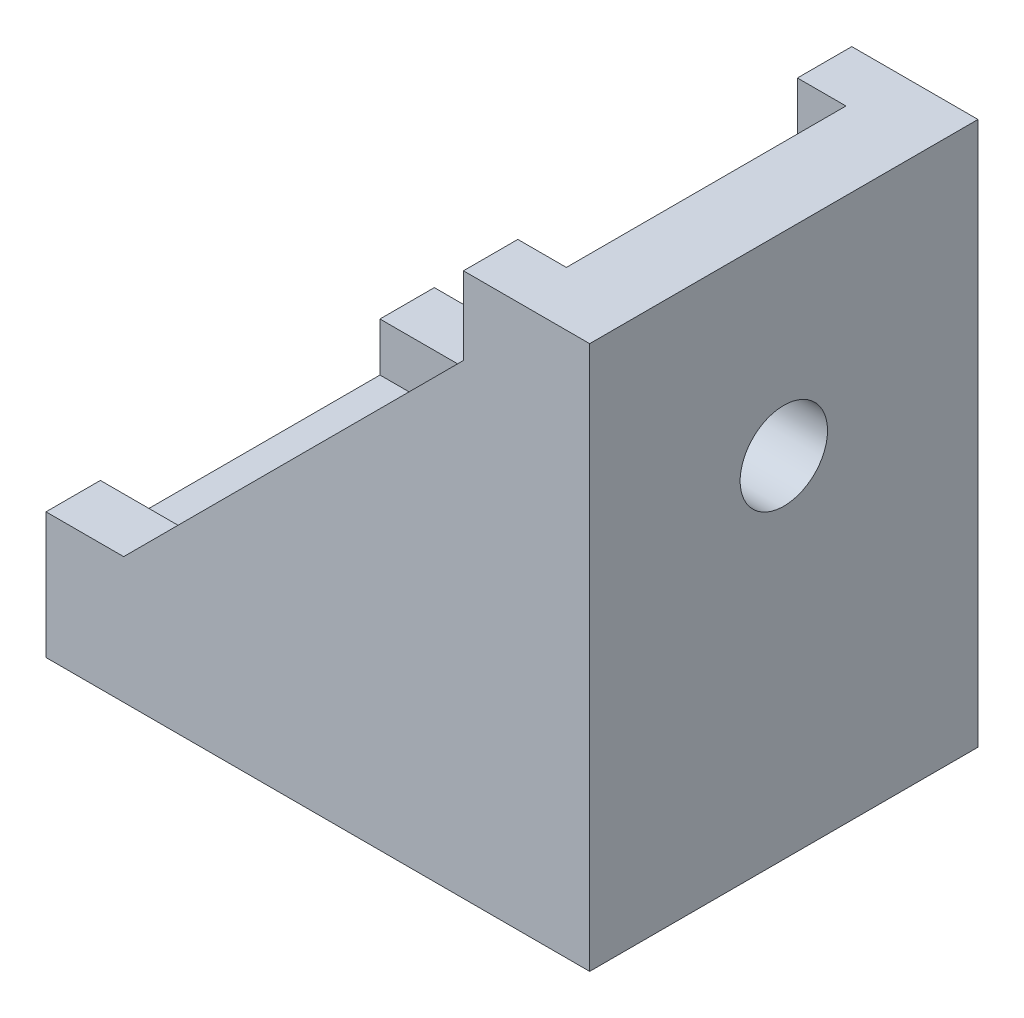
from build123d import *

# Parameters (mm, degrees)
SKETCH_1_W          = 28
SKETCH_1_H          = 28
EXTRUDE_1_DEPTH     = 20
CUT_EXTRUDE_1_DEPTH = 20
SKETCH_3_W          = 24
SKETCH_3_H          = 14.4
CUT_EXTRUDE_2_DEPTH = 24
SKETCH_4_R          = 2.25
CUT_EXTRUDE_3_DEPTH = 10
SKETCH_5_R          = 2.25
CUT_EXTRUDE_4_DEPTH = 10


with BuildPart() as part:
    # 草图1 → 凸台-拉伸1 (new body)
    with BuildSketch(Plane.XY):
        with Locations((14, 14)):
            Rectangle(SKETCH_1_W, SKETCH_1_H)
    extrude(amount=EXTRUDE_1_DEPTH)

    # 草图2 → 切除-拉伸1 (cut)
    with BuildSketch(Plane.XY.offset(20)):
        Polygon((21.5, 28), (21.5, 24), (4, 6.5), (0, 6.5), (0, 28), align=None)
    extrude(amount=-CUT_EXTRUDE_1_DEPTH, mode=Mode.SUBTRACT)

    # 草图3 → 切除-拉伸2 (cut)
    with BuildSketch(Plane(origin=(0, 28, 0), x_dir=(1, 0, 0), z_dir=(0, 1, 0))):
        with Locations((12, -10)):
            Rectangle(SKETCH_3_W, SKETCH_3_H)
    extrude(amount=-CUT_EXTRUDE_2_DEPTH, mode=Mode.SUBTRACT)

    # 草图4 → 切除-拉伸3 (cut)
    with BuildSketch(Plane.XZ):
        with Locations(Location((10, 10, 0), (0, 0, 270))):
            Circle(SKETCH_4_R)
    extrude(amount=-CUT_EXTRUDE_3_DEPTH, mode=Mode.SUBTRACT)

    # 草图5 → 切除-拉伸4 (cut)
    with BuildSketch(Plane(origin=(28, 0, 0), x_dir=(0, 0, -1), z_dir=(1, 0, 0))):
        with Locations((-10, 18)):
            Circle(SKETCH_5_R)
    extrude(amount=-CUT_EXTRUDE_4_DEPTH, mode=Mode.SUBTRACT)


solid = part.part
